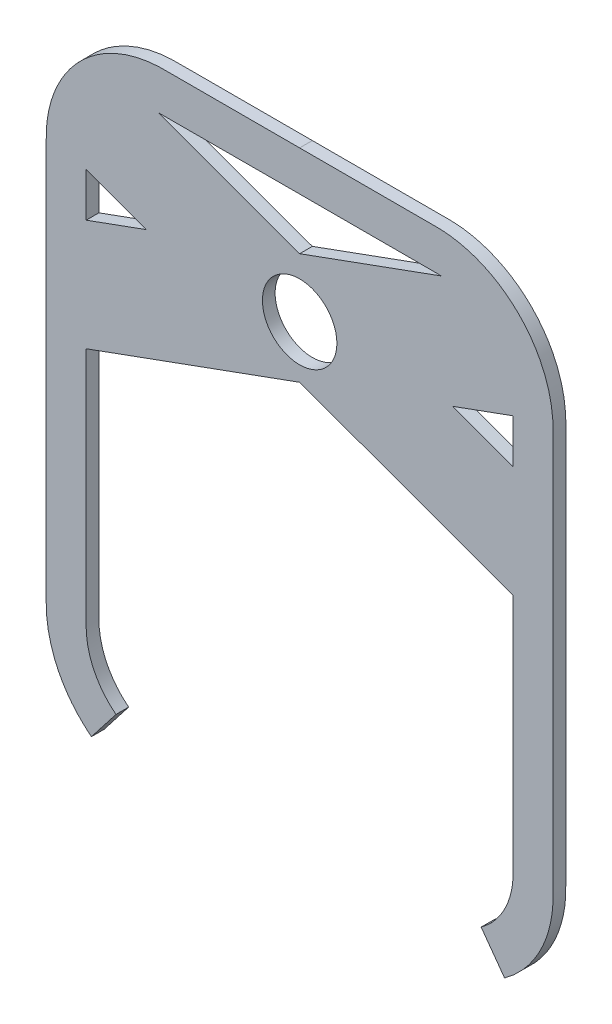
from build123d import *

# Parameters (mm, degrees)
SKETCH_1_R      = 8.2
EXTRUDE_1_DEPTH = 1.4


with BuildPart() as part:
    # Эскиз1 → Бобышка-Вытянуть1 (new, symmetric)
    # profile 1 of 2: a face of its own
    with BuildSketch(Plane.XY):
        with BuildLine():
            Line((-45.838137947, 1.617859223), (-40.435700993, 8.564345741))
            add(Edge.make_bspline(
                [(0, 128.005165198), (-1.885796689, 128.005165198), (-5.657390894, 128.005165238), (-11.314777238, 128.005165059), (-16.029280345, 128.005165605), (-19.80085054, 128.005164494), (-22.629616359, 128.005167888), (-24.986640746, 128.005157268), (-26.872889274, 128.005178935), (-28.050362285, 128.005123794), (-28.995621004, 128.005236978), (-29.578923087, 128.004948819), (-30.062707755, 128.005540326), (-30.343006733, 128.002802568), (-30.686477802, 127.992673068), (-31.014997779, 127.975404194), (-31.335264625, 127.953810687), (-31.883337205, 127.905328609), (-32.993464549, 127.761461102), (-34.557648996, 127.420213149), (-36.992821054, 126.593700024), (-39.826526702, 125.055433906), (-42.729003998, 122.492220933), (-44.605984871, 119.868025084), (-45.726608339, 117.556018613), (-46.365564448, 115.738097125), (-46.723662644, 114.173847911), (-46.902698944, 112.904280803), (-46.969735078, 112.101891453), (-46.99272986, 111.545880038), (-46.99926172, 111.218068501), (-47.000197486, 111.000817698), (-46.999948336, 110.610931063), (-47.000028655, 110.155781267), (-47.000004875, 109.744395867), (-46.999999565, 109.335701561), (-47.000000653, 108.859813627), (-47.000006007, 107.972029157), (-46.999995952, 106.256963583), (-47.000001343, 103.900503148), (-46.999999225, 100.128601145), (-47.000000263, 95.414260767), (-46.99999993, 89.75682206), (-47.000000018, 84.099444955), (-46.999999989, 76.556253937), (-47.000000004, 67.127272729), (-47, 57.698288187), (-47, 50.155102504), (-47.000000002, 44.497709393), (-46.999999993, 38.840330705), (-47.00000002, 34.125803603), (-46.999999966, 30.354282382), (-47.000000103, 27.996852903), (-46.999999822, 26.111433123), (-47.000000678, 24.695934107), (-46.999998, 23.520913949), (-47.000002782, 22.689446346), (-46.999996077, 22.285945165), (-47.000006887, 22.035681925), (-46.999962599, 21.859523186), (-46.997546007, 21.667170007), (-46.989269535, 21.343740987), (-46.962815808, 20.785041865), (-46.891088439, 19.984626856), (-46.751056961, 19.032735761), (-46.493288265, 17.778180958), (-46.0373002, 16.23606681), (-45.036225625, 13.873081404), (-43.294871603, 11.156633831), (-41.445890492, 9.349992567), (-40.435700993, 8.564345741)],
                knots=[0, 0, 0, 0, 0.024861017, 0.049722034, 0.074583051, 0.08701356, 0.099444069, 0.111874577, 0.118089832, 0.124305086, 0.127412713, 0.13052034, 0.132074154, 0.133627967, 0.136735594, 0.13845308, 0.140006894, 0.142950849, 0.149166103, 0.161596612, 0.17402712, 0.198888137, 0.223749154, 0.248610172, 0.26104068, 0.273471189, 0.285901697, 0.292116952, 0.298332206, 0.301439833, 0.302993647, 0.30454746, 0.306101274, 0.307655087, 0.310702106, 0.311479013, 0.313032827, 0.316977969, 0.323193223, 0.335623732, 0.34805424, 0.372915257, 0.397776275, 0.422637292, 0.447498309, 0.497220343, 0.546942378, 0.571803395, 0.596664412, 0.621525429, 0.646386446, 0.658816955, 0.671247463, 0.677462718, 0.683677972, 0.689893226, 0.693000853, 0.694554667, 0.695331574, 0.696108481, 0.697662294, 0.699216108, 0.702323735, 0.708538989, 0.714754243, 0.720969498, 0.733400006, 0.745830515, 0.770691532, 0.795552549, 0.795552549, 0.795552549, 0.795552549], degree=3))
            add(Edge.make_bspline(
                [(39.963641391, 8.210175062), (41.005353733, 8.963850422), (42.924246751, 10.714716389), (44.763087846, 13.38435292), (45.845839047, 15.726388821), (46.352336568, 17.259322333), (46.651249444, 18.512932619), (46.821281331, 19.463532708), (46.937363693, 20.423142646), (46.98340569, 21.15048887), (46.996872931, 21.629100218), (46.999700283, 21.838047089), (47.000055196, 21.982824026), (46.999968541, 22.242160021), (47.000022601, 22.642629864), (46.999992503, 23.242574445), (47.000004325, 24.186924805), (46.999998565, 25.372690803), (47.000000828, 27.266938837), (46.999999725, 29.635768402), (47.000000159, 33.425325892), (46.999999946, 38.162468285), (47.000000014, 43.846955334), (46.999999996, 49.53146483), (47.000000002, 57.110802882), (47.000000004, 65.128174302), (47, 72.198126519), (47, 75.987796313), (47.000000003, 79.339435941), (47.000000025, 83.638495338), (46.999999904, 89.322986047), (47.000000308, 94.381576208), (47.000000061, 98.018964565), (46.999999965, 99.998389832), (47.000000361, 101.571814822), (47.000001566, 103.619042365), (46.999994491, 105.902163304), (47.000009551, 107.798746182), (46.99997121, 108.978567805), (47.000049913, 109.935120222), (46.999849539, 110.503999024), (47.000260848, 111.025447786), (46.998585374, 111.304686835), (46.982462962, 111.894626552), (46.925680933, 112.684149986), (46.761709161, 113.969342945), (46.421362001, 115.541340562), (45.800298392, 117.377370052), (44.700627897, 119.711499061), (42.841499657, 122.36847979), (39.949077914, 124.970760163), (37.113177712, 126.539797368), (34.67447929, 127.3879196), (33.101108307, 127.741617107), (31.825517783, 127.916130901), (31.016432604, 127.979821168), (30.462374337, 128.000321481), (30.16766567, 128.004617598), (30.027895322, 128.005257064), (29.780626995, 128.005112212), (29.489630353, 128.005182751), (29.013940484, 128.005155194), (28.186186156, 128.005172386), (27.001226192, 128.005162814), (25.106661669, 128.005166575), (22.737985487, 128.005164731), (19.895775468, 128.005165321), (16.106091754, 128.005165128), (11.369011263, 128.005165222), (5.684504268, 128.005165191), (1.894834921, 128.005165198), (0, 128.005165198)],
                knots=[0, 0, 0, 0, 0.024980171, 0.049960342, 0.062450427, 0.074940513, 0.081185555, 0.087430598, 0.093675641, 0.099920683, 0.101481944, 0.103043205, 0.103823835, 0.104604465, 0.106165726, 0.109288248, 0.112410769, 0.118655812, 0.124900854, 0.13739094, 0.149881025, 0.174861196, 0.199841367, 0.224821538, 0.249801709, 0.29976205, 0.330516908, 0.343006993, 0.349722392, 0.374702563, 0.399682734, 0.424662905, 0.441390839, 0.447635882, 0.450758403, 0.462133161, 0.474623246, 0.480868289, 0.487113332, 0.490235853, 0.493358375, 0.494919635, 0.496480896, 0.499603417, 0.50584846, 0.512093503, 0.524583588, 0.537073674, 0.549563759, 0.57454393, 0.599524101, 0.624504272, 0.636994357, 0.649484442, 0.655729485, 0.661974528, 0.665097049, 0.66665831, 0.66743894, 0.668219571, 0.669780831, 0.671342092, 0.674464613, 0.680709656, 0.686954699, 0.699444784, 0.71193487, 0.724424955, 0.749405126, 0.774385297, 0.799365468, 0.799365468, 0.799365468, 0.799365468], degree=3))
            Line((39.963641391, 8.210175062), (45.121927815, 1.080512996))
            add(Edge.make_bspline(
                [(45.121927815, 1.080512996), (46.702815079, 2.224279592), (49.614858371, 4.881949046), (52.963237431, 9.741585255), (54.771770032, 14.319873207), (55.568827584, 18.151665035), (55.799195934, 20.597725321), (55.800148278, 22.536982724), (55.799914397, 24.420908172), (55.800029034, 26.794799108), (55.799992393, 29.635342364), (55.800004392, 33.425571864), (55.799998508, 38.162384728), (55.800000401, 43.846977684), (55.799999889, 49.531458988), (55.800000095, 57.110806185), (55.799999701, 66.584978393), (55.800000802, 76.059149273), (55.799998616, 83.638498592), (55.800005281, 89.32297353), (55.799980259, 95.007590362), (55.800058111, 99.744328946), (55.799899349, 103.534709924), (55.800384185, 106.374790587), (55.79886729, 108.750128827), (55.80196204, 110.631101502), (55.789360467, 112.582382361), (55.540245024, 115.020827338), (54.715870394, 118.849102858), (52.874658337, 123.412759587), (49.489257904, 128.249824956), (45.100255805, 132.199565917), (40.794573303, 134.581140152), (37.095238231, 135.868640215), (34.227263857, 136.51108421), (31.797786404, 136.780180382), (29.832715182, 136.809772237), (27.955122464, 136.80250778), (25.57817903, 136.806046766), (21.791808749, 136.804656602), (17.053111909, 136.805334731), (9.474416038, 136.805063479), (3.789669843, 136.805165198), (0, 136.805165198)],
                knots=[0, 0, 0, 0, 0.024980171, 0.049960342, 0.074940513, 0.087430598, 0.099920683, 0.106165726, 0.112410769, 0.124900854, 0.13739094, 0.149881025, 0.174861196, 0.199841367, 0.224821538, 0.249801709, 0.29976205, 0.349722392, 0.374702563, 0.399682734, 0.424662905, 0.449643076, 0.462133161, 0.474623246, 0.487113332, 0.493358375, 0.499603417, 0.512093503, 0.524583588, 0.549563759, 0.57454393, 0.599524101, 0.624504272, 0.636994357, 0.649484442, 0.661974528, 0.668219571, 0.674464613, 0.686954699, 0.699444784, 0.724424955, 0.749405126, 0.799365468, 0.799365468, 0.799365468, 0.799365468], degree=3))
            add(Edge.make_bspline(
                [(0, 136.805165198), (-3.771593378, 136.805165198), (-9.429191291, 136.80510563), (-16.971823795, 136.805264479), (-21.687701148, 136.804867358), (-25.456453974, 136.805681456), (-27.820931102, 136.803608981), (-29.691884194, 136.807863139), (-31.63814643, 136.790533773), (-34.062292398, 136.537424608), (-36.919346947, 135.917564152), (-40.610691791, 134.663165113), (-44.914524382, 132.328022734), (-49.318425522, 128.437955451), (-52.736970872, 123.658553095), (-54.620560877, 119.140151709), (-55.488054842, 115.336310471), (-55.765412457, 112.923623163), (-55.806378302, 110.959914283), (-55.796317729, 109.093251618), (-55.801248928, 106.726627201), (-55.799672798, 103.900929785), (-55.800188908, 100.128354826), (-55.799935835, 95.414344445), (-55.800017135, 89.756799663), (-55.799995624, 84.099450864), (-55.800001951, 76.556250314), (-55.800004321, 67.127275793), (-55.799981239, 55.812483983), (-55.800055809, 46.383530535), (-55.799903296, 38.840283631), (-55.800369136, 33.183077063), (-55.798911657, 28.468011288), (-55.801513499, 25.168891868), (-55.797344694, 23.281453225), (-55.814418338, 21.402381289), (-55.67932307, 18.937681461), (-54.997888508, 15.110965936), (-53.348389264, 10.494795037), (-50.176691279, 5.552652512), (-47.371086686, 2.810067528), (-45.838137947, 1.617859223)],
                knots=[0, 0, 0, 0, 0.049722034, 0.074583051, 0.099444069, 0.111874577, 0.124305086, 0.13052034, 0.136735594, 0.149166103, 0.161596612, 0.17402712, 0.198888137, 0.223749154, 0.248610172, 0.273471189, 0.285901697, 0.298332206, 0.30454746, 0.310762715, 0.323193223, 0.335623732, 0.34805424, 0.372915257, 0.397776275, 0.422637292, 0.447498309, 0.497220343, 0.546942378, 0.596664412, 0.621525429, 0.646386446, 0.671247463, 0.683677972, 0.689893226, 0.696108481, 0.708538989, 0.720969498, 0.745830515, 0.770691532, 0.795552549, 0.795552549, 0.795552549, 0.795552549], degree=3))
        make_face()
    # profile 2 of 2: a face of its own
    with BuildSketch(Plane.XY):
        Polygon((-31.143509559, 127.96659668), (0, 116.63128621), (31.143509559, 127.96659668), (40.724618917, 130.882252716), (51.231185012, 117.726319904), (47, 109.217902698), (33.684051901, 104.371293948), (47, 99.524685199), (50.113146789, 83.558001182), (47, 75.004700676), (0, 92.111301687), (-47, 75.004700676), (-50.432305981, 75.004700676), (-51.87775846, 93.153627768), (-47, 99.524685199), (-33.684051901, 104.371293948), (-47, 109.217902698), (-50.432305981, 120.496770488), (-33.684051901, 132.060390317), align=None)
        with Locations((0, 103.636945021)):
            Circle(SKETCH_1_R, mode=Mode.SUBTRACT)
    extrude(amount=EXTRUDE_1_DEPTH, both=True)


solid = part.part
